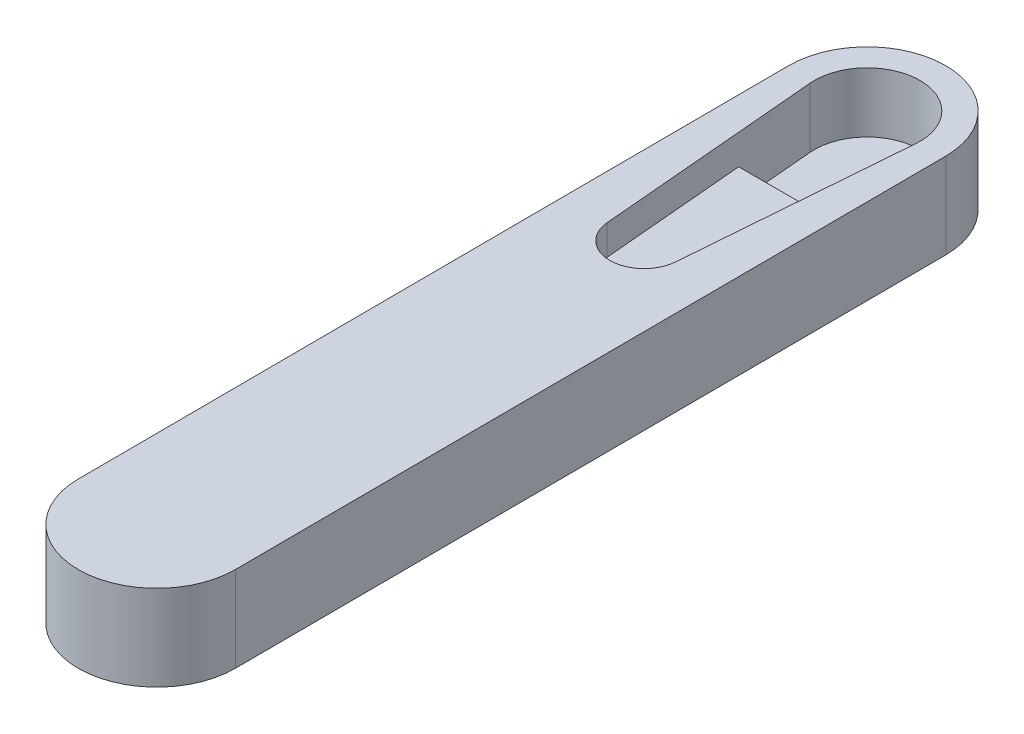
from build123d import *

# Parameters (mm, degrees)
EXTRUDE_1_DEPTH     = 6
CUT_EXTRUDE_1_DEPTH = 2.1
CUT_EXTRUDE_2_DEPTH = 2.1


with BuildPart() as part:
    # Эскиз2 → Бобышка-Вытянуть1 (new body)
    with BuildSketch(Plane(origin=(0, 0, 0), x_dir=(1, 0, 0), z_dir=(0, 1, 0))):
        with BuildLine():
            Line((-5.696343687, 30.010357476), (-5.499915116, -19.989642524))
            ThreePointArc((-5.499915116, -19.989642524), (0.021649418, -25.467993105), (5.5, -19.946428571))
            Line((5.5, -19.946428571), (5.303571429, 30.053571429))
            ThreePointArc((5.303571429, 30.053571429), (-0.217993105, 35.53192201), (-5.696343687, 30.010357476))
        make_face()
    extrude(amount=EXTRUDE_1_DEPTH)

    # Эскиз3 → Вырез-Вытянуть1 (cut)
    with BuildSketch(Plane(origin=(0, 6, 0), x_dir=(1, 0, 0), z_dir=(0, 1, 0))):
        with BuildLine():
            Line((-3.882448388, 29.711113982), (-2.525666878, 14.123849568))
            ThreePointArc((-2.525666878, 14.123849568), (-0.125279076, 11.931987312), (2.257813124, 14.142641811))
            Line((2.257813124, 14.142641811), (3.492083281, 29.740085357))
            ThreePointArc((3.492083281, 29.740085357), (-0.210921731, 33.7319359), (-3.882448388, 29.711113982))
        make_face()
    extrude(amount=-CUT_EXTRUDE_1_DEPTH, mode=Mode.SUBTRACT)

    # Эскиз4 → Вырез-Вытянуть2 (cut)
    with BuildSketch(Plane(origin=(0, 3.9, 0), x_dir=(1, 0, 0), z_dir=(0, 1, 0))):
        with BuildLine():
            Line((-3.405520008, 24.231964452), (3.056209977, 24.231964452))
            Line((3.056209977, 24.231964452), (3.492083281, 29.740085357))
            ThreePointArc((3.492083281, 29.740085357), (-0.210921731, 33.7319359), (-3.882448388, 29.711113982))
            Line((-3.882448388, 29.711113982), (-3.405520008, 24.231964452))
        make_face()
    extrude(amount=-CUT_EXTRUDE_2_DEPTH, mode=Mode.SUBTRACT)


solid = part.part
